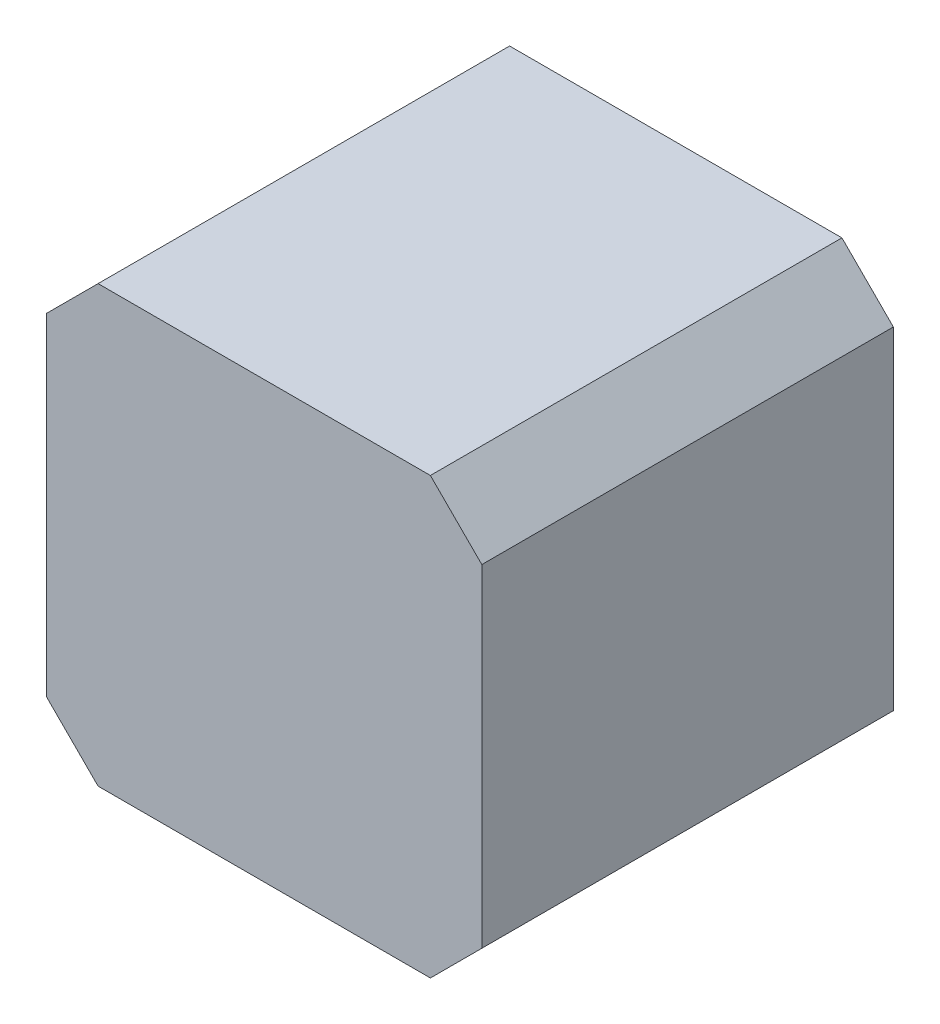
from build123d import *

# Parameters (mm, degrees)
SKETCH1_W           = 42.3
SKETCH1_H           = 42.3
BOSS_EXTRUDE1_DEPTH = 40
CHAMFER1_SIZE       = 5


with BuildPart() as part:
    # Sketch1 → Boss-Extrude1 (new body)
    with BuildSketch(Plane.XY):
        Rectangle(SKETCH1_W, SKETCH1_H)
    extrude(amount=BOSS_EXTRUDE1_DEPTH)

    # Chamfer1
    chamfer1_edges = [part.edges().sort_by_distance(p)[0] for p in [
        (-21.15, 21.15, 20),
        (21.15, 21.15, 20),
        (21.15, -21.15, 20),
        (-21.15, -21.15, 20),
    ]]
    chamfer(chamfer1_edges, length=CHAMFER1_SIZE)


solid = part.part
